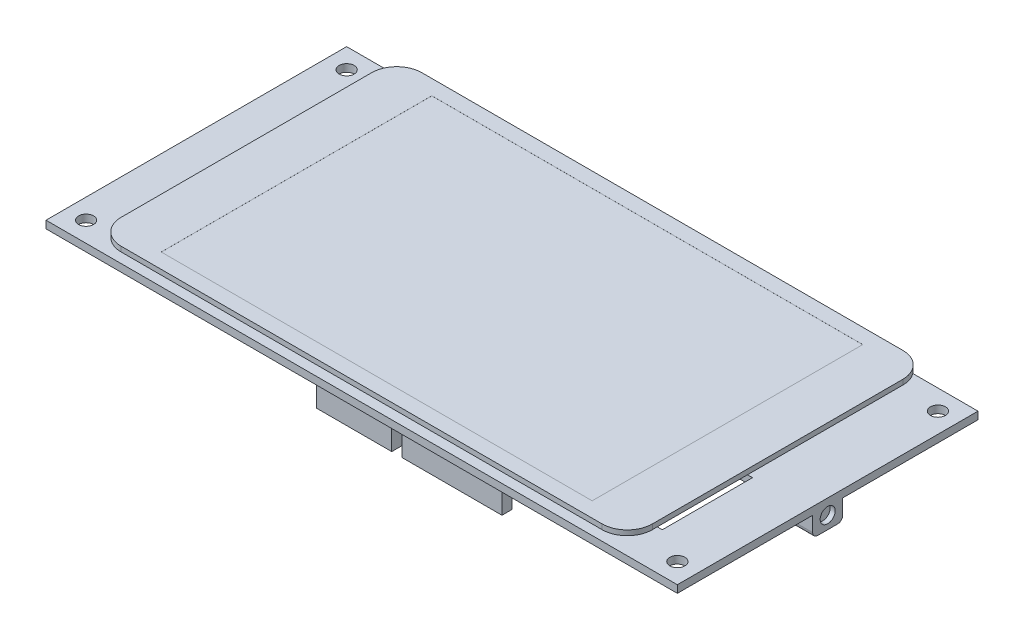
from build123d import *

# Parameters (mm, degrees)
SKETCH1_W           = 126
SKETCH1_H           = 60
SKETCH1_R           = 1.5
BOSS_EXTRUDE1_DEPTH = 1.5
SKETCH2_W           = 100
SKETCH2_H           = 50
BOSS_EXTRUDE2_DEPTH = 2
SKETCH3_W           = 106
SKETCH3_H           = 60
BOSS_EXTRUDE3_DEPTH = 1
FILLET1_R           = 5
SKETCH4_W           = 86
SKETCH4_H           = 54
CUT_EXTRUDE1_DEPTH  = 0.01
SKETCH6_W           = 18
SKETCH6_H           = 18
CUT_EXTRUDE2_DEPTH  = 1.5
SKETCH7_W           = 20
SKETCH7_H           = 2
SKETCH7_W_2         = 15
SKETCH7_W_3         = 25
BOSS_EXTRUDE4_DEPTH = 9
SKETCH8_W           = 3
SKETCH8_H           = 9
CUT_EXTRUDE3_DEPTH  = 2
SKETCH9_W           = 5
SKETCH9_H           = 6
BOSS_EXTRUDE5_DEPTH = 4
SKETCH10_R          = 1.5
CUT_EXTRUDE4_DEPTH  = 1
FILLET2_R           = 1


with BuildPart() as part:
    # Sketch1 → Boss-Extrude1 (new body)
    with BuildSketch(Plane(origin=(0, 0, 0), x_dir=(1, 0, 0), z_dir=(0, 1, 0))):
        Rectangle(SKETCH1_W, SKETCH1_H)
        with Locations(Location((-59, 26, 0), (0, 0, 270))):
            Circle(SKETCH1_R, mode=Mode.SUBTRACT)
        with Locations(Location((-59, -26, 0), (0, 0, 90))):
            Circle(SKETCH1_R, mode=Mode.SUBTRACT)
        with Locations(Location((59, -26, 0), (0, 0, 270))):
            Circle(SKETCH1_R, mode=Mode.SUBTRACT)
        with Locations(Location((59, 26, 0), (0, 0, 90))):
            Circle(SKETCH1_R, mode=Mode.SUBTRACT)
    extrude(amount=BOSS_EXTRUDE1_DEPTH)

    # Sketch2 → Boss-Extrude2 (add)
    with BuildSketch(Plane(origin=(0, 1.5, 0), x_dir=(1, 0, 0), z_dir=(0, 1, 0))):
        Rectangle(SKETCH2_W, SKETCH2_H)
    extrude(amount=BOSS_EXTRUDE2_DEPTH)

    # Sketch3 → Boss-Extrude3 (add)
    with BuildSketch(Plane(origin=(0, 3.5, 0), x_dir=(1, 0, 0), z_dir=(0, 1, 0))):
        Rectangle(SKETCH3_W, SKETCH3_H)
    extrude(amount=BOSS_EXTRUDE3_DEPTH)

    # Fillet1
    fillet1_edges = [part.edges().sort_by_distance(p)[0] for p in [
        (53, 4, 30),
        (53, 4, -30),
        (-53, 4, -30),
        (-53, 4, 30),
    ]]
    fillet(fillet1_edges, radius=FILLET1_R)

    # Sketch4 → Cut-Extrude1 (cut)
    with BuildSketch(Plane(origin=(0, 4.5, 0), x_dir=(1, 0, 0), z_dir=(0, 1, 0))):
        Rectangle(SKETCH4_W, SKETCH4_H)
    extrude(amount=-CUT_EXTRUDE1_DEPTH, mode=Mode.SUBTRACT)

    # Sketch6 → Cut-Extrude2 (cut)
    with BuildSketch(Plane.XZ):
        with Locations((43, 13)):
            Rectangle(SKETCH6_W, SKETCH6_H)
    extrude(amount=-CUT_EXTRUDE2_DEPTH, mode=Mode.SUBTRACT)

    # Sketch7 → Boss-Extrude4 (add)
    with BuildSketch(Plane.XZ):
        with Locations((13, 24)):
            Rectangle(SKETCH7_W, SKETCH7_H)
        with Locations((-6.5, 24)):
            Rectangle(SKETCH7_W_2, SKETCH7_H)
        with Locations((20.5, -24)):
            Rectangle(SKETCH7_W_3, SKETCH7_H)
        with Locations((-4, -24)):
            Rectangle(SKETCH7_W, SKETCH7_H)
    extrude(amount=BOSS_EXTRUDE4_DEPTH)

    # Sketch8 → Cut-Extrude3 (cut)
    with BuildSketch(Plane(origin=(0, 0, -25), x_dir=(-1, 0, 0), z_dir=(0, 0, -1))):
        with Locations((-31.5, -4.5)):
            Rectangle(SKETCH8_W, SKETCH8_H)
    extrude(amount=-CUT_EXTRUDE3_DEPTH, mode=Mode.SUBTRACT)

    # Sketch9 → Boss-Extrude5 (add)
    with BuildSketch(Plane.XZ):
        with Locations((60.5, 0)):
            Rectangle(SKETCH9_W, SKETCH9_H)
    extrude(amount=BOSS_EXTRUDE5_DEPTH)

    # Sketch10 → Cut-Extrude4 (cut)
    with BuildSketch(Plane(origin=(63, 0, 0), x_dir=(0, 0, -1), z_dir=(1, 0, 0))):
        with Locations((0, -1.469545864)):
            Circle(SKETCH10_R)
    extrude(amount=-CUT_EXTRUDE4_DEPTH, mode=Mode.SUBTRACT)

    # Fillet2
    fillet2_edges = [part.edges().sort_by_distance(p)[0] for p in [
        (60.5, -4, 3),
        (60.5, -4, -3),
    ]]
    fillet(fillet2_edges, radius=FILLET2_R)


solid = part.part
